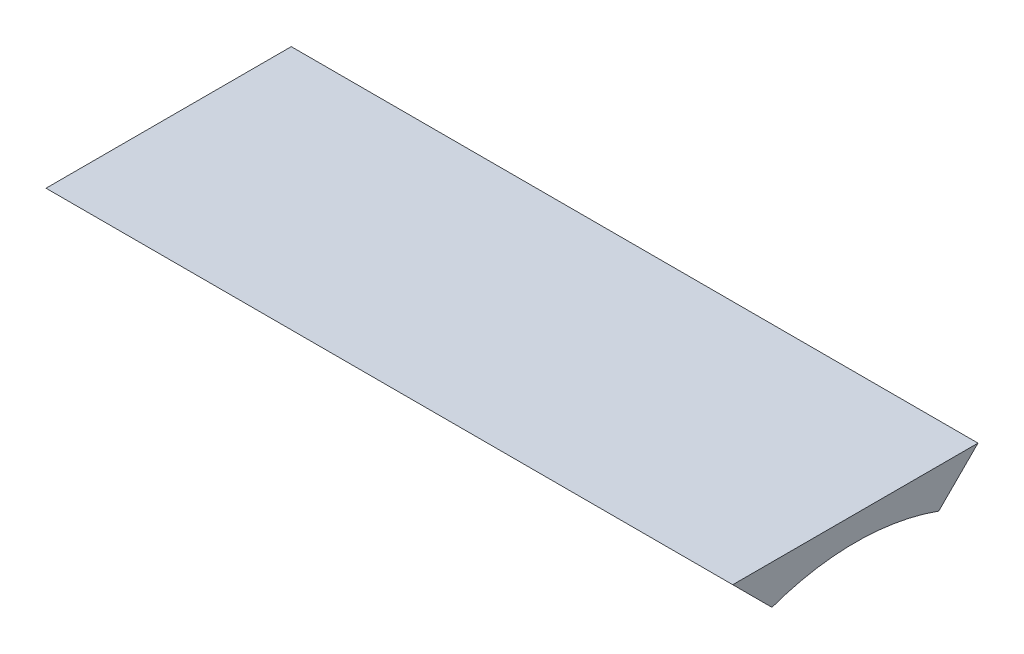
from build123d import *

# Parameters (mm, degrees)
EXTRUDE_1_DEPTH = 70


with BuildPart() as part:
    # Эскиз1 → Бобышка-Вытянуть1 (new body)
    with BuildSketch(Plane(origin=(0, 0, 0), x_dir=(0, 0, -1), z_dir=(1, 0, 0))):
        with BuildLine():
            Line((-12.5, 27.510635891), (-8.5, 23.510635891))
            ThreePointArc((-8.5, 23.510635891), (0, 25), (8.5, 23.510635891))
            Line((8.5, 23.510635891), (12.5, 27.510635891))
            Line((12.5, 27.510635891), (-12.5, 27.510635891))
        make_face()
    extrude(amount=EXTRUDE_1_DEPTH)


solid = part.part
